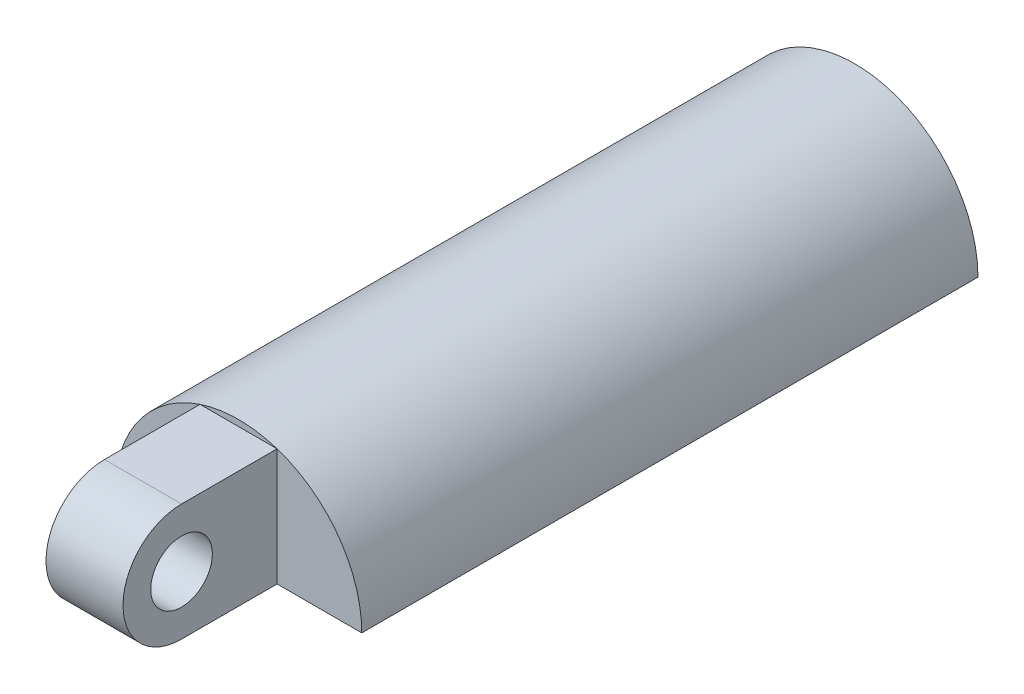
from build123d import *

# Parameters (mm, degrees)
EXTRUDE_1_DEPTH     = 40
EXTRUDE_2_DEPTH     = 10
CUT_EXTRUDE_1_REACH = 53.713
CUT_EXTRUDE_2_REACH = 53.713
SKETCH_8_4_R        = 2


with BuildPart() as part:
    # 스케치1 → 보스-돌출1 (new body)
    with BuildSketch(Plane.XY):
        with BuildLine():
            ThreePointArc((8, 0), (0, 8), (-8, 0))
            Line((-8, 0), (8, 0))
        make_face()
    extrude(amount=EXTRUDE_1_DEPTH)

    # 스케치6 → 보스-돌출2 (add)
    with BuildSketch(Plane.XY.offset(40)):
        Polygon((0, 0), (2.5, 0), (2.5, 7.599342077), (-2.5, 7.599342077), (-2.5, 0), align=None)
    extrude(amount=EXTRUDE_2_DEPTH)

    # 스케치8 → 컷-돌출1 (cut, up to next)
    with BuildSketch(Plane(origin=(2.5, 0, 0), x_dir=(0, 0, -1), z_dir=(1, 0, 0)), mode=Mode.PRIVATE) as cut_extrude_1_sk1:
        with BuildLine():
            ThreePointArc((-46.200328962, 0), (-48.887102119, 1.112897881), (-50, 3.799671038))
            Line((-50, 3.799671038), (-50, 0))
            Line((-50, 0), (-46.200328962, 0))
        make_face()
    cut_extrude_1_tool1 = extrude(cut_extrude_1_sk1.sketch, amount=-CUT_EXTRUDE_1_REACH, mode=Mode.PRIVATE) & part.part
    # 스케치8 → 컷-돌출1 (cut, up to next)
    with BuildSketch(Plane(origin=(2.5, 0, 0), x_dir=(0, 0, -1), z_dir=(1, 0, 0)), mode=Mode.PRIVATE) as cut_extrude_1_sk2:
        with BuildLine():
            Line((-50, 7.599342077), (-50, 3.799671038))
            ThreePointArc((-50, 3.799671038), (-48.887102119, 6.486444196), (-46.200328962, 7.599342077))
            Line((-46.200328962, 7.599342077), (-50, 7.599342077))
        make_face()
    cut_extrude_1_tool2 = extrude(cut_extrude_1_sk2.sketch, amount=-CUT_EXTRUDE_1_REACH, mode=Mode.PRIVATE) & part.part
    add(cut_extrude_1_tool1.solids().sort_by_distance((2.5, 0.848725, 49.151275))[0], mode=Mode.SUBTRACT)
    add(cut_extrude_1_tool2.solids().sort_by_distance((2.5, 6.750617, 49.151275))[0], mode=Mode.SUBTRACT)

    # 스케치8<4> → 컷-돌출2 (cut, up to next)
    with BuildSketch(Plane(origin=(2.5, 0, 0), x_dir=(0, 0, -1), z_dir=(1, 0, 0)), mode=Mode.PRIVATE) as cut_extrude_2_sk1:
        with Locations((-46.200328962, 3.799671038)):
            Circle(SKETCH_8_4_R)
    cut_extrude_2_tool1 = extrude(cut_extrude_2_sk1.sketch, amount=-CUT_EXTRUDE_2_REACH, mode=Mode.PRIVATE) & part.part
    add(cut_extrude_2_tool1.solids().sort_by_distance((2.5, 3.799671, 46.200329))[0], mode=Mode.SUBTRACT)


solid = part.part
